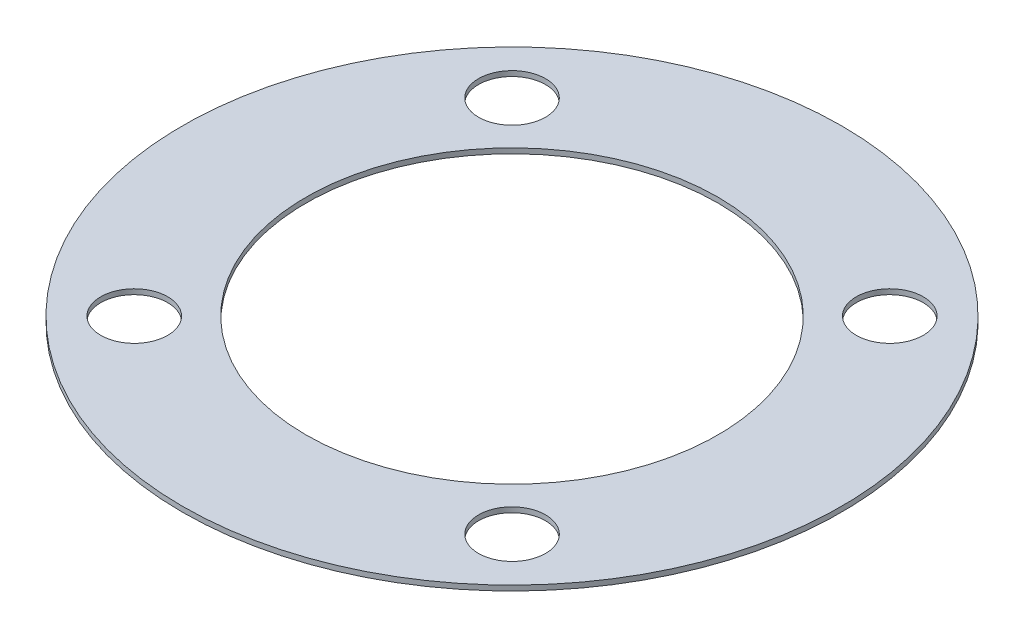
from build123d import *

# Parameters (mm, degrees)
SKETCH1_R           = 32
BOSS_EXTRUDE1_DEPTH = 0.5
SKETCH2_R           = 20
CUT_EXTRUDE1_DEPTH  = 46.257596048
SKETCH3_R           = 3.25
CUT_EXTRUDE2_DEPTH  = 46.257596048


with BuildPart() as part:
    # Sketch1 → Boss-Extrude1 (new body)
    with BuildSketch(Plane(origin=(0, 0, 0), x_dir=(1, 0, 0), z_dir=(0, 1, 0))):
        with Locations(Location((0, 0, 0), (0, 0, 270))):
            Circle(SKETCH1_R)
    extrude(amount=BOSS_EXTRUDE1_DEPTH)

    # Sketch2 → Cut-Extrude1 (cut, through all)
    with BuildSketch(Plane(origin=(0, 0.5, 0), x_dir=(1, 0, 0), z_dir=(0, 1, 0))):
        with Locations(Location((0, 0, 0), (0, 0, 270))):
            Circle(SKETCH2_R)
    extrude(amount=-CUT_EXTRUDE1_DEPTH, mode=Mode.SUBTRACT)

    # Sketch3 → Cut-Extrude2 (cut, through all)
    with BuildSketch(Plane(origin=(0, 0.5, 0), x_dir=(1, 0, 0), z_dir=(0, 1, 0))):
        with Locations(Location((18.342451558, 18.339331739, 0), (0, 0, 270))):
            Circle(SKETCH3_R)
        with Locations(Location((-18.339331739, 18.342451558, 0), (0, 0, 270))):
            Circle(SKETCH3_R)
        with Locations(Location((-18.339331739, -18.342451558, 0), (0, 0, 270))):
            Circle(SKETCH3_R)
        with Locations(Location((18.342451558, -18.339331739, 0), (0, 0, 270))):
            Circle(SKETCH3_R)
    extrude(amount=-CUT_EXTRUDE2_DEPTH, mode=Mode.SUBTRACT)


solid = part.part
